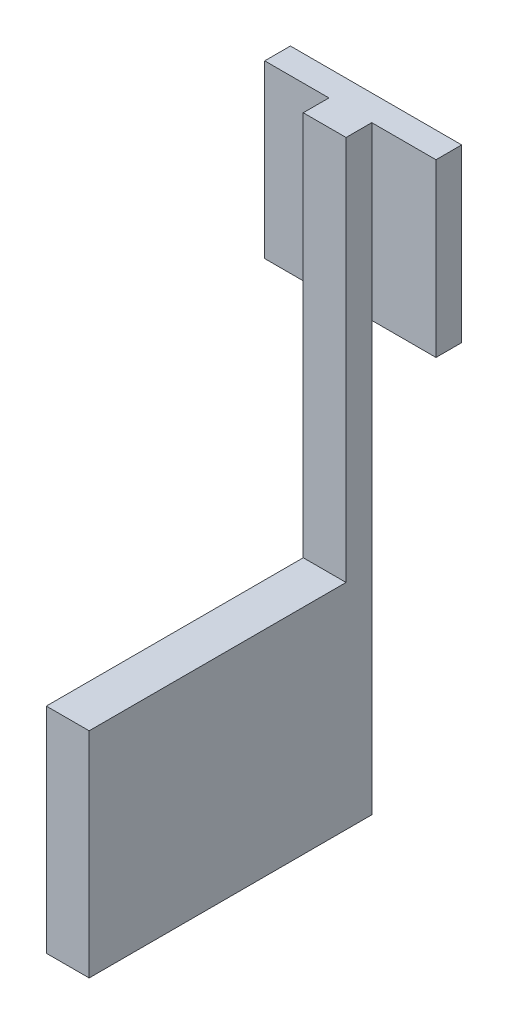
from build123d import *

# Parameters (mm, degrees)
SKETCH_1_W      = 20
SKETCH_1_H      = 20
EXTRUDE_1_DEPTH = 3
SKETCH_2_W      = 5
SKETCH_2_H      = 20
EXTRUDE_2_DEPTH = 3
SKETCH_3_W      = 5
SKETCH_3_H      = 3
EXTRUDE_3_DEPTH = 50
SKETCH_4_W      = 5
SKETCH_4_H      = 25
EXTRUDE_4_DEPTH = 30


with BuildPart() as part:
    # 草图1 → 凸台-拉伸1 (new body)
    with BuildSketch(Plane.XY):
        Rectangle(SKETCH_1_W, SKETCH_1_H)
    extrude(amount=EXTRUDE_1_DEPTH)

    # 草图2 → 凸台-拉伸2 (add)
    with BuildSketch(Plane.XY.offset(3)):
        Rectangle(SKETCH_2_W, SKETCH_2_H)
    extrude(amount=EXTRUDE_2_DEPTH)

    # 草图3 → 凸台-拉伸3 (add)
    with BuildSketch(Plane.XZ.offset(10)):
        with Locations((0, 4.5)):
            Rectangle(SKETCH_3_W, SKETCH_3_H)
    extrude(amount=EXTRUDE_3_DEPTH)

    # 草图4 → 凸台-拉伸4 (add)
    with BuildSketch(Plane.XY.offset(6)):
        with Locations((0, -47.5)):
            Rectangle(SKETCH_4_W, SKETCH_4_H)
    extrude(amount=EXTRUDE_4_DEPTH)


solid = part.part
